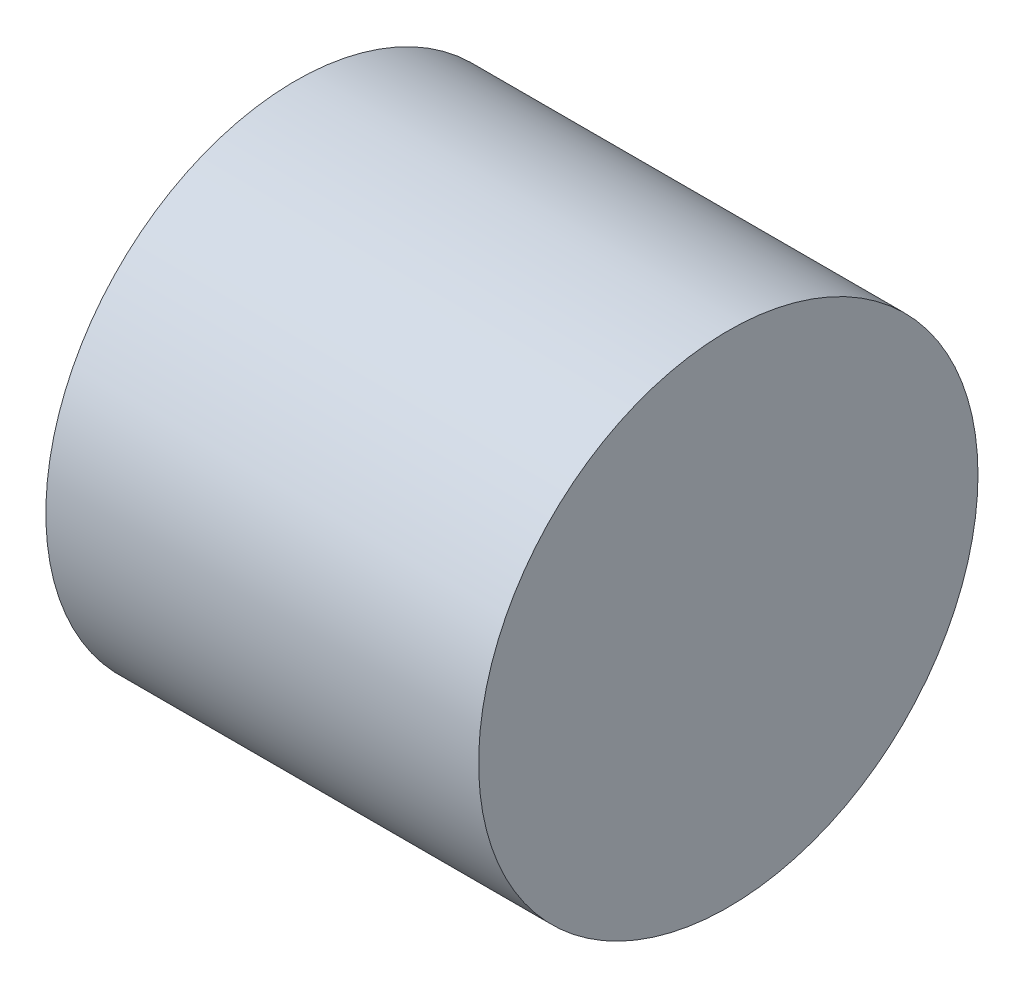
from build123d import *

# Parameters (mm, degrees)
SKETCH_1_R      = 5.769352896
EXTRUDE_1_DEPTH = 10


with BuildPart() as part:
    # 草图1 → 凸台-拉伸1 (new body)
    with BuildSketch(Plane(origin=(0, 0, 0), x_dir=(0, 0, -1), z_dir=(1, 0, 0))):
        with Locations((-21.386323929, 21.012347695)):
            Circle(SKETCH_1_R)
    extrude(amount=EXTRUDE_1_DEPTH)


solid = part.part
